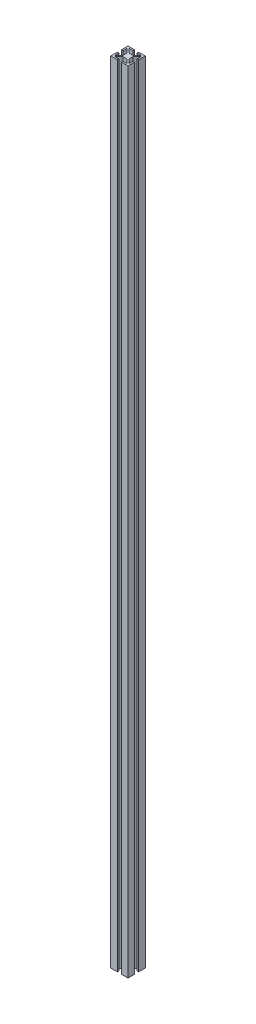
from build123d import *

# Parameters (mm, degrees)
BOSS_EXTRUDE1_DEPTH = 1163.0025


with BuildPart() as part:
    # Sketch1 → Boss-Extrude1 (new body)
    with BuildSketch(Plane(origin=(11.365010382, 0, 9.846206226), x_dir=(1, 0, 0), z_dir=(0, 1, 0))):
        Polygon((-24.065010382, 22.546206226), (-14.229795365, 22.546206226), (-14.229795365, 20.336406226), (-20.292645817, 20.336406226), (-14.310945817, 14.354706226), (-8.419074947, 14.354706226), (-2.437374947, 20.336406226), (-8.5002254, 20.336406226), (-8.5002254, 22.546206226), (1.334989618, 22.546206226), (1.334989618, 12.710991208), (-0.874810382, 12.710991208), (-0.874810382, 18.773841661), (-6.856510382, 12.792141661), (-6.856510382, 6.900270791), (-0.874810382, 0.918570791), (-0.874810382, 6.981421243), (1.334989618, 6.981421243), (1.334989618, -2.853793774), (-8.5002254, -2.853793774), (-8.5002254, -0.643993774), (-2.437374947, -0.643993774), (-8.419074947, 5.337706226), (-14.310945817, 5.337706226), (-20.292645817, -0.643993774), (-14.229795365, -0.643993774), (-14.229795365, -2.853793774), (-24.065010382, -2.853793774), (-24.065010382, 6.981421243), (-21.855210382, 6.981421243), (-21.855210382, 0.918570791), (-15.873510382, 6.900270791), (-15.873510382, 12.792141661), (-21.855210382, 18.773841661), (-21.855210382, 12.710991208), (-24.065010382, 12.710991208), align=None)
    extrude(amount=BOSS_EXTRUDE1_DEPTH)


solid = part.part
